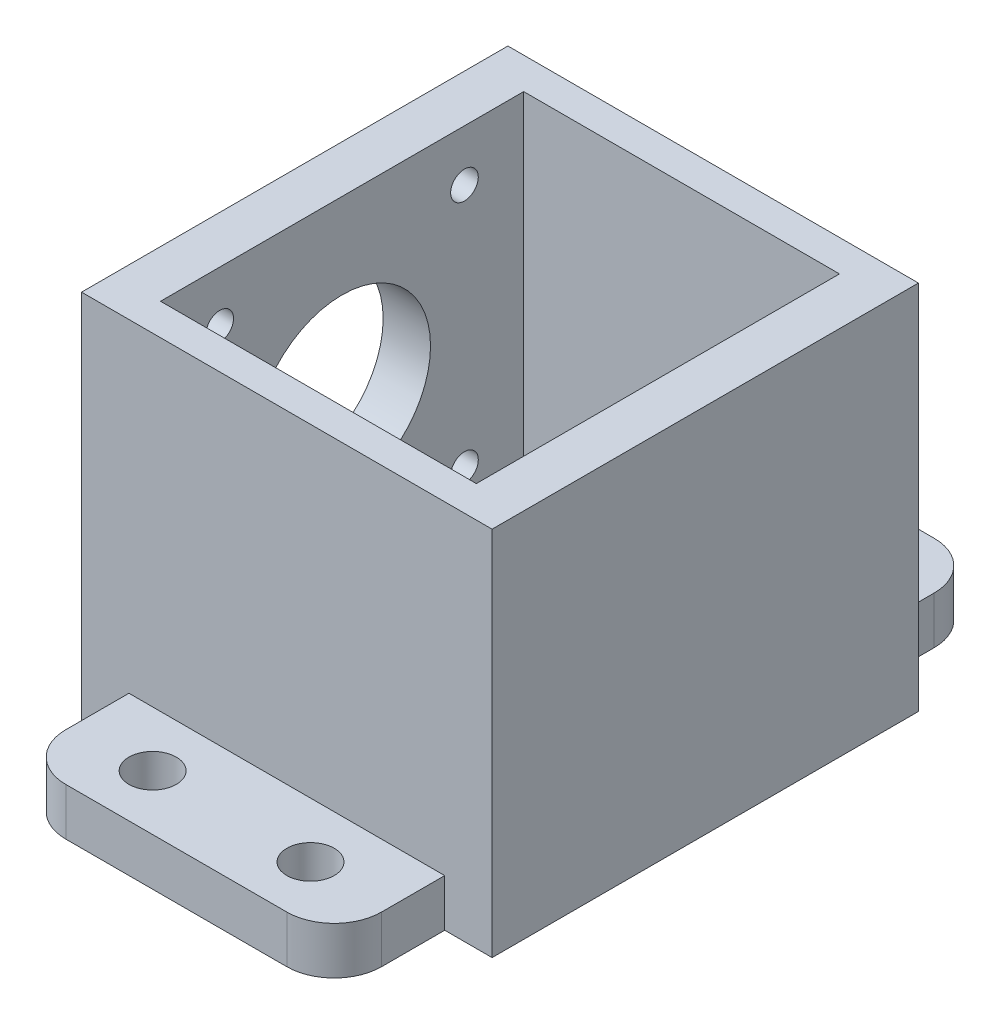
from build123d import *

# Parameters (mm, degrees)
SKETCH_1_W          = 52
SKETCH_1_H          = 54
EXTRUDE_1_DEPTH     = 47
CUT_EXTRUDE_START   = 47
SKETCH_2_W          = 40
SKETCH_2_H          = 46
CUT_EXTRUDE_1_DEPTH = 43
CUT_EXTRUDE_START_2 = -20
SKETCH_4_R          = 11.2
SKETCH_4_R_2        = 1.75
CUT_EXTRUDE_3_DEPTH = 6
SKETCH_5_W          = 40
SKETCH_5_H          = 14
SKETCH_5_R          = 3
EXTRUDE_2_DEPTH     = 6
FILLET_1_R          = 6


with BuildPart() as part:
    # 草图1 → 凸台-拉伸1 (new body)
    with BuildSketch(Plane(origin=(0, 0, 0), x_dir=(1, 0, 0), z_dir=(0, 1, 0))):
        Rectangle(SKETCH_1_W, SKETCH_1_H)
    extrude(amount=EXTRUDE_1_DEPTH)

    # 草图2 → 切除-拉伸1 (cut)
    with BuildSketch(Plane(origin=(0, 0, 0), x_dir=(1, 0, 0), z_dir=(0, 1, 0)).offset(CUT_EXTRUDE_START)):
        Rectangle(SKETCH_2_W, SKETCH_2_H)
    extrude(amount=-CUT_EXTRUDE_1_DEPTH, mode=Mode.SUBTRACT)

    # 草图4 → 切除-拉伸3 (cut)
    with BuildSketch(Plane(origin=(0, 0, 0), x_dir=(0, 0, -1), z_dir=(1, 0, 0)).offset(CUT_EXTRUDE_START_2)):
        with Locations((0, 25)):
            Circle(SKETCH_4_R)
        with Locations((-15.5, 40.5)):
            Circle(SKETCH_4_R_2)
        with Locations((15.5, 40.5)):
            Circle(SKETCH_4_R_2)
        with Locations((15.5, 9.5)):
            Circle(SKETCH_4_R_2)
        with Locations((-15.5, 9.5)):
            Circle(SKETCH_4_R_2)
    extrude(amount=-CUT_EXTRUDE_3_DEPTH, mode=Mode.SUBTRACT)

    # 草图5 → 凸台-拉伸2 (add)
    # profile 1 of 2: a face of its own
    with BuildSketch(Plane(origin=(0, 0, 0), x_dir=(1, 0, 0), z_dir=(0, 1, 0))):
        with Locations((0, 34)):
            Rectangle(SKETCH_5_W, SKETCH_5_H)
        with Locations(Location((-10, 34, 0), (0, 0, 270))):
            Circle(SKETCH_5_R, mode=Mode.SUBTRACT)
        with Locations(Location((10, 34, 0), (0, 0, 270))):
            Circle(SKETCH_5_R, mode=Mode.SUBTRACT)
    # profile 2 of 2: a face of its own
    with BuildSketch(Plane(origin=(0, 0, 0), x_dir=(1, 0, 0), z_dir=(0, 1, 0))):
        with Locations((0, -34)):
            Rectangle(SKETCH_5_W, SKETCH_5_H)
        with Locations(Location((10, -34, 0), (0, 0, 90))):
            Circle(SKETCH_5_R, mode=Mode.SUBTRACT)
        with Locations(Location((-10, -34, 0), (0, 0, 90))):
            Circle(SKETCH_5_R, mode=Mode.SUBTRACT)
    extrude(amount=EXTRUDE_2_DEPTH)

    # 圆角1
    fillet_1_edges = [part.edges().sort_by_distance(p)[0] for p in [
        (-20, 3, -41),
        (20, 3, -41),
        (-20, 3, 41),
        (20, 3, 41),
    ]]
    fillet(fillet_1_edges, radius=FILLET_1_R)


solid = part.part
